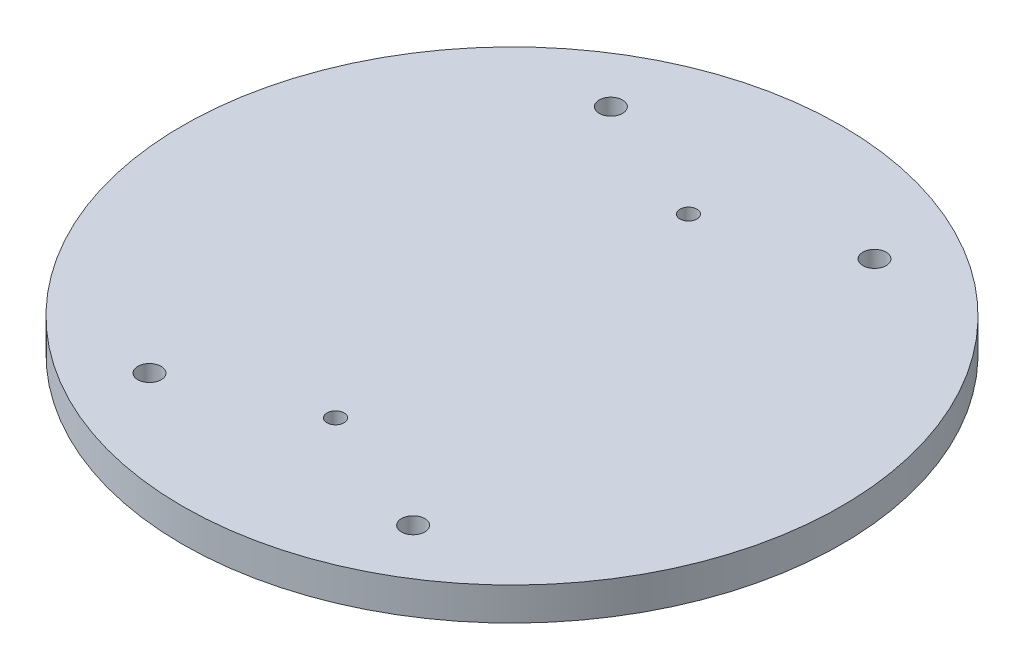
from build123d import *

# Parameters (mm, degrees)
SKETCH1_R                   = 63.5
BOSS_EXTRUDE1_DEPTH         = 6.35
F_8_CLEARANCE_HOLE1_D       = 4.4958
TAP_DRILL_FOR_M4X0_7_TAP1_D = 3.3


with BuildPart() as part:
    # Sketch1 → Boss-Extrude1 (new body)
    with BuildSketch(Plane(origin=(0, 0, 0), x_dir=(1, 0, 0), z_dir=(0, 1, 0))):
        with Locations(Location((0, 0, 0), (0, 0, 270))):
            Circle(SKETCH1_R)
    extrude(amount=BOSS_EXTRUDE1_DEPTH)

    # #8 Clearance Hole1 (through all)
    with Locations(Plane(origin=(0, 6.35, 0), x_dir=(1, 0, 0), z_dir=(0, 1, 0))):
        with Locations((-25.4, -44.45), (25.4, -44.45), (25.4, 44.45), (-25.4, 44.45)):
            Hole(F_8_CLEARANCE_HOLE1_D / 2)

    # Tap Drill for M4x0.7 Tap1 (through all)
    with Locations(Plane(origin=(0, 6.35, 0), x_dir=(1, 0, 0), z_dir=(0, 1, 0))):
        with Locations((0, 34), (0, -34)):
            Hole(TAP_DRILL_FOR_M4X0_7_TAP1_D / 2)


solid = part.part
